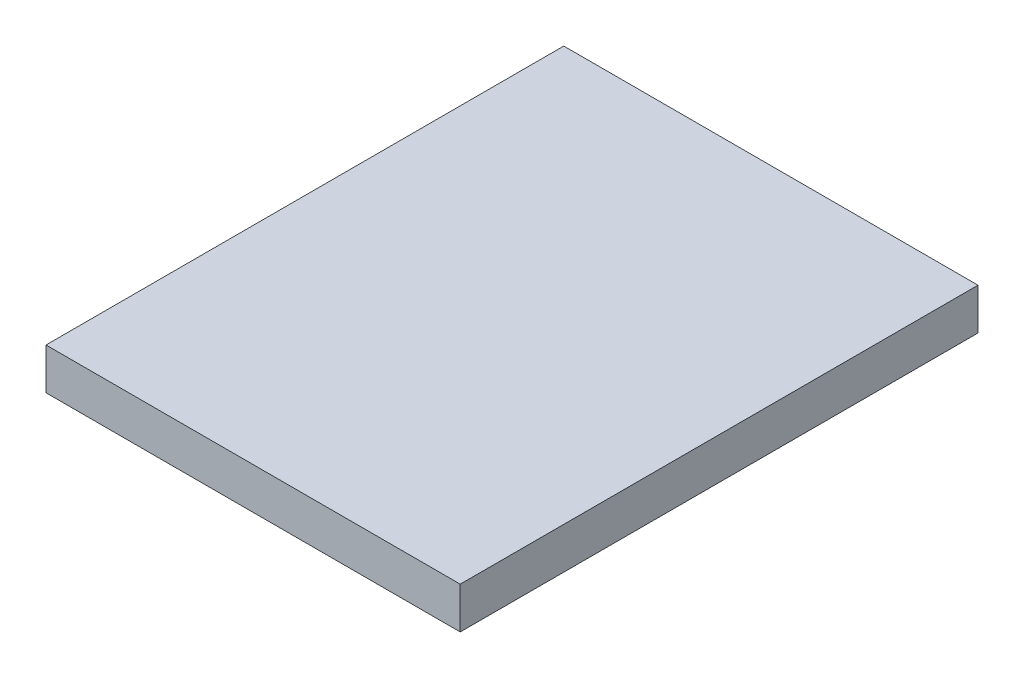
from build123d import *

# Parameters (mm, degrees)
SKETCH1_W           = 100
SKETCH1_H           = 125
BOSS_EXTRUDE1_DEPTH = 10


with BuildPart() as part:
    # Sketch1 → Boss-Extrude1 (new body)
    with BuildSketch(Plane(origin=(0, 0, 0), x_dir=(1, 0, 0), z_dir=(0, 1, 0))):
        with Locations((-11.375661376, -10.912698413)):
            Rectangle(SKETCH1_W, SKETCH1_H)
    extrude(amount=BOSS_EXTRUDE1_DEPTH)


solid = part.part
